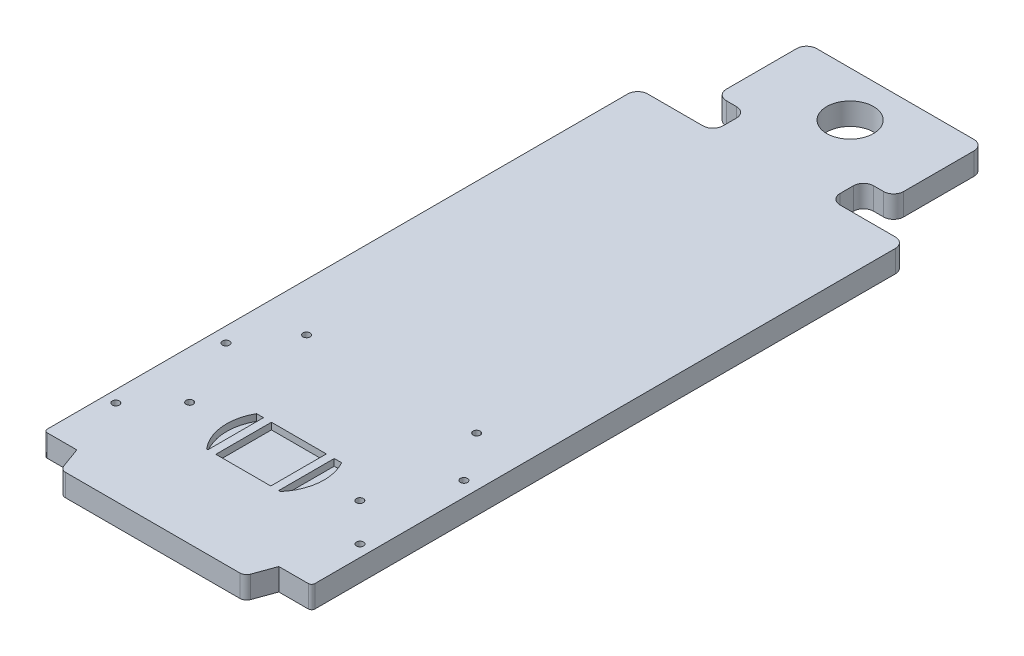
from build123d import *

# Parameters (mm, degrees)
SKETCH1_R                 = 8.89
BOSS_EXTRUDE1_DEPTH       = 8.382
FILLET3_R                 = 1.27
TAP_DRILL_FOR_6_32_TAP2_D = 2.7051
LPATTERN1_COUNT           = 2
LPATTERN1_PITCH           = 44.39
LPATTERN1_COUNT_DIR2      = 2
LPATTERN1_PITCH_DIR2      = 64.59
TAP_DRILL_FOR_6_32_TAP3_D = 2.7051
TAP_DRILL_FOR_6_32_TAP5_D = 2.7051
CUT_EXTRUDE2_DEPTH        = 231.337524251
CUT_EXTRUDE2_DEPTH_BACK   = 2.54


with BuildPart() as part:
    # Sketch1 → Boss-Extrude1 (new body)
    with BuildSketch(Plane(origin=(0, 0, 0), x_dir=(1, 0, 0), z_dir=(0, 1, 0))):
        with BuildLine():
            Line((-15.926997076, 220.899744797), (43.763002924, 220.899744797))
            ThreePointArc((43.763002924, 220.899744797), (46.457079761, 219.783821634), (47.573002924, 217.089744797))
            Line((47.573002924, 217.089744797), (47.573002924, 190.419744797))
            ThreePointArc((47.573002924, 190.419744797), (46.457079761, 187.725667961), (43.763002924, 186.609744797))
            Line((43.763002924, 186.609744797), (39.953002924, 186.609744797))
            ThreePointArc((39.953002924, 186.609744797), (37.258926088, 185.493821634), (36.143002924, 182.799744797))
            Line((36.143002924, 182.799744797), (36.143002924, 177.719744797))
            ThreePointArc((36.143002924, 177.719744797), (37.258926088, 175.025667961), (39.953002924, 173.909744797))
            Line((39.953002924, 173.909744797), (60.908002924, 173.909744797))
            ThreePointArc((60.908002924, 173.909744797), (63.602079761, 172.793821634), (64.718002924, 170.099744797))
            Line((64.718002924, 170.099744797), (64.718002924, -51.515255203))
            Line((64.718002924, -51.515255203), (52.272002924, -51.515255203))
            Line((52.272002924, -51.515255203), (49.413478553, -59.368986367))
            ThreePointArc((49.413478553, -59.368986367), (48.483543444, -60.580901395), (47.026659296, -61.040255203))
            Line((47.026659296, -61.040255203), (-19.190653447, -61.040255203))
            ThreePointArc((-19.190653447, -61.040255203), (-20.647537596, -60.580901395), (-21.577472704, -59.368986367))
            Line((-21.577472704, -59.368986367), (-24.435997076, -51.515255203))
            Line((-24.435997076, -51.515255203), (-36.881997076, -51.515255203))
            Line((-36.881997076, -51.515255203), (-36.881997076, 170.099744797))
            ThreePointArc((-36.881997076, 170.099744797), (-35.766073912, 172.793821634), (-33.071997076, 173.909744797))
            Line((-33.071997076, 173.909744797), (-12.116997076, 173.909744797))
            ThreePointArc((-12.116997076, 173.909744797), (-9.422920239, 175.025667961), (-8.306997076, 177.719744797))
            Line((-8.306997076, 177.719744797), (-8.306997076, 182.799744797))
            ThreePointArc((-8.306997076, 182.799744797), (-9.422920239, 185.493821634), (-12.116997076, 186.609744797))
            Line((-12.116997076, 186.609744797), (-15.926997076, 186.609744797))
            ThreePointArc((-15.926997076, 186.609744797), (-18.621073912, 187.725667961), (-19.736997076, 190.419744797))
            Line((-19.736997076, 190.419744797), (-19.736997076, 217.089744797))
            ThreePointArc((-19.736997076, 217.089744797), (-18.621073912, 219.783821634), (-15.926997076, 220.899744797))
        make_face()
        with Locations(Location((13.918002924, 203.754744797, 0), (0, 0, 270))):
            Circle(SKETCH1_R, mode=Mode.SUBTRACT)
    extrude(amount=BOSS_EXTRUDE1_DEPTH)

    # Fillet3
    fillet3_edges = [part.edges().sort_by_distance(p)[0] for p in [
        (-36.881997076, 4.191, 51.515255203),
        (64.718002924, 4.191, 51.515255203),
    ]]
    fillet(fillet3_edges, radius=FILLET3_R)

    # Tap Drill for #6-32 Tap2 (through all)
    with Locations(Plane(origin=(0, 8.382, 0), x_dir=(1, 0, 0), z_dir=(0, 1, 0))):
        with Locations((-18.626997076, -14.470255203)):
            tap_drill_for_6_32_tap2 = Hole(TAP_DRILL_FOR_6_32_TAP2_D / 2)

    # LPattern1: Tap Drill for _6-32 Tap2 2 × 2
    with Locations(*[(j * LPATTERN1_PITCH_DIR2, 0, -i * LPATTERN1_PITCH) for i in range(LPATTERN1_COUNT) for j in range(LPATTERN1_COUNT_DIR2) if (i, j) != (0, 0)]):
        add(tap_drill_for_6_32_tap2, mode=Mode.SUBTRACT)

    # Tap Drill for #6-32 Tap3 (through all)
    with Locations(Plane(origin=(0, 8.382, 0), x_dir=(1, 0, 0), z_dir=(0, 1, 0))):
        with Locations((-31.251997076, 11.924744797), (59.088002924, 11.924744797)):
            Hole(TAP_DRILL_FOR_6_32_TAP3_D / 2)

    # Tap Drill for #6-32 Tap5 (through all)
    with Locations(Plane(origin=(0, 8.382, 0), x_dir=(1, 0, 0), z_dir=(0, 1, 0))):
        with Locations((-32.451997076, -28.700255203), (60.288002924, -28.700255203)):
            Hole(TAP_DRILL_FOR_6_32_TAP5_D / 2)

    # Sketch2 → Cut-Extrude2 (cut, two sides: drawn at the far end of the back side and taken through both)
    with BuildSketch(Plane(origin=(0, 8.382, 0), x_dir=(1, 0, 0), z_dir=(0, 1, 0)).offset(-CUT_EXTRUDE2_DEPTH_BACK)):
        with BuildLine():
            Line((-0.076281623, -26.570255203), (0.413729291, -26.570255203))
            Line((0.413729291, -26.570255203), (0.413729291, -5.470255203))
            Line((0.413729291, -5.470255203), (-2.245226951, -5.470255203))
            ThreePointArc((-2.245226951, -5.470255203), (-4.485024518, -16.361968965), (-0.076281623, -26.570255203))
        make_face()
        Polygon((3.413729291, -26.570255203), (13.918002924, -26.570255203), (24.266068116, -26.570255203), (24.266068116, -5.470255203), (13.918002924, -5.470255203), (3.413729291, -5.470255203), align=None)
        with BuildLine():
            Line((27.266068116, -5.470255203), (27.266068116, -26.570255203))
            Line((27.266068116, -26.570255203), (27.912287472, -26.570255203))
            ThreePointArc((27.912287472, -26.570255203), (31.255019163, -20.926095035), (32.418002924, -14.470255203))
            ThreePointArc((32.418002924, -14.470255203), (31.824283285, -9.821048426), (30.081232799, -5.470255203))
            Line((30.081232799, -5.470255203), (27.266068116, -5.470255203))
        make_face()
    extrude(amount=CUT_EXTRUDE2_DEPTH + CUT_EXTRUDE2_DEPTH_BACK, mode=Mode.SUBTRACT)


solid = part.part
